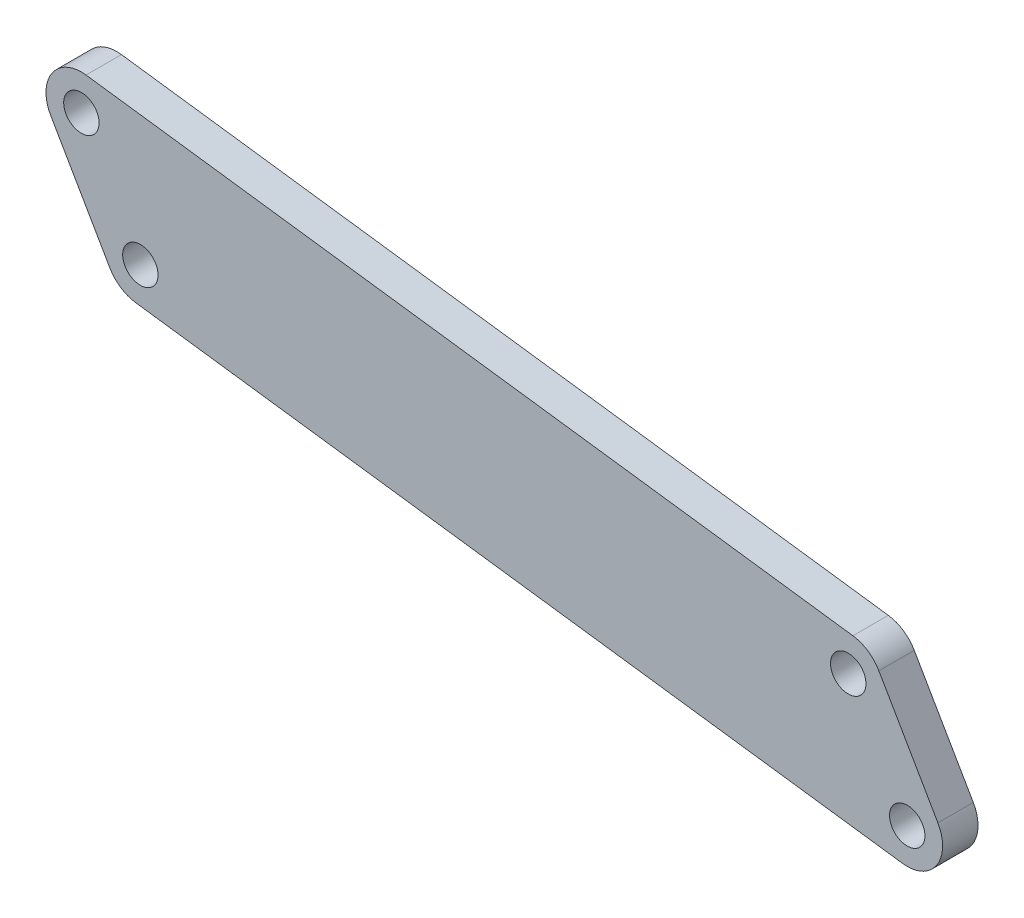
from build123d import *

# Parameters (mm, degrees)
SKETCH2_R           = 1.5
BOSS_EXTRUDE1_DEPTH = 3


with BuildPart() as part:
    # Sketch2 → Boss-Extrude1 (new body)
    with BuildSketch(Plane.XY):
        with BuildLine():
            Line((-64.603797092, 11.633976159), (0.396202908, 2.973722121))
            ThreePointArc((0.396202908, 2.973722121), (1.668649479, 2.493112295), (2.598076211, 1.5))
            Line((2.598076211, 1.5), (7.598076211, -7.160254038))
            ThreePointArc((7.598076211, -7.160254038), (7.493112295, -10.328903517), (4.603797092, -11.633976159))
            Line((4.603797092, -11.633976159), (-60.396202908, -2.973722121))
            ThreePointArc((-60.396202908, -2.973722121), (-61.668649479, -2.493112295), (-62.598076211, -1.5))
            Line((-62.598076211, -1.5), (-67.598076211, 7.160254038))
            ThreePointArc((-67.598076211, 7.160254038), (-67.493112295, 10.328903517), (-64.603797092, 11.633976159))
        make_face()
        with Locations((-60, 0)):
            Circle(SKETCH2_R, mode=Mode.SUBTRACT)
        with Locations((-65, 8.660254038)):
            Circle(SKETCH2_R, mode=Mode.SUBTRACT)
        Circle(SKETCH2_R, mode=Mode.SUBTRACT)
        with Locations((5, -8.660254038)):
            Circle(SKETCH2_R, mode=Mode.SUBTRACT)
    extrude(amount=BOSS_EXTRUDE1_DEPTH)


solid = part.part
